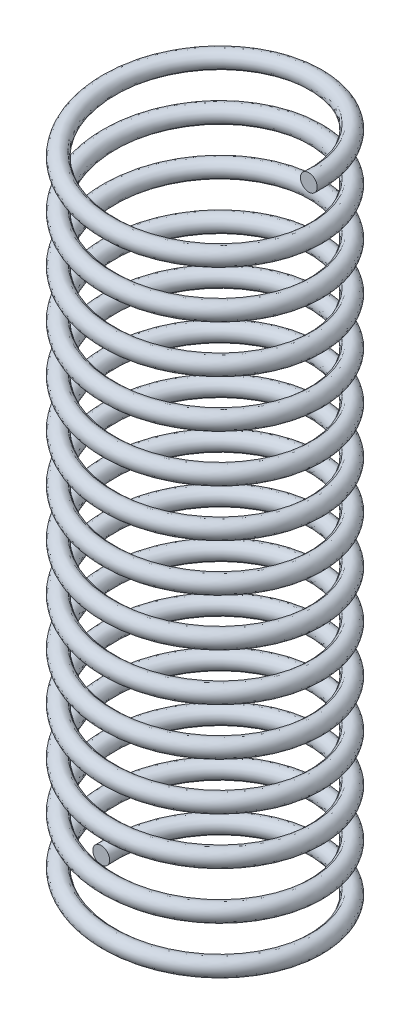
from build123d import *

# Parameters (mm, degrees)
SWEEP1_PITCH       = 3.214413793
SWEEP1_HEIGHT      = 46.609
SWEEP1_RADIUS      = 7.0485
SWEEP1_START_ANGLE = -90
SKETCH1_R          = 0.5715


with BuildPart() as part:
    # Sweep1: sweep along a helix
    with BuildLine() as sweep1_path:
        add(Helix(SWEEP1_PITCH, SWEEP1_HEIGHT, SWEEP1_RADIUS, center=(0, 0, 0), direction=(0, 1, 0), lefthand=True, mode=Mode.PRIVATE).rotate(Axis((0, 0, 0), (0, 1, 0)), SWEEP1_START_ANGLE))
    # Sketch1 → Sweep1 (sweep)
    with BuildSketch(Plane.XY):
        with Locations((-7.0485, 0)):
            Circle(SKETCH1_R)
    sweep(path=sweep1_path.line, is_frenet=True)


solid = part.part
